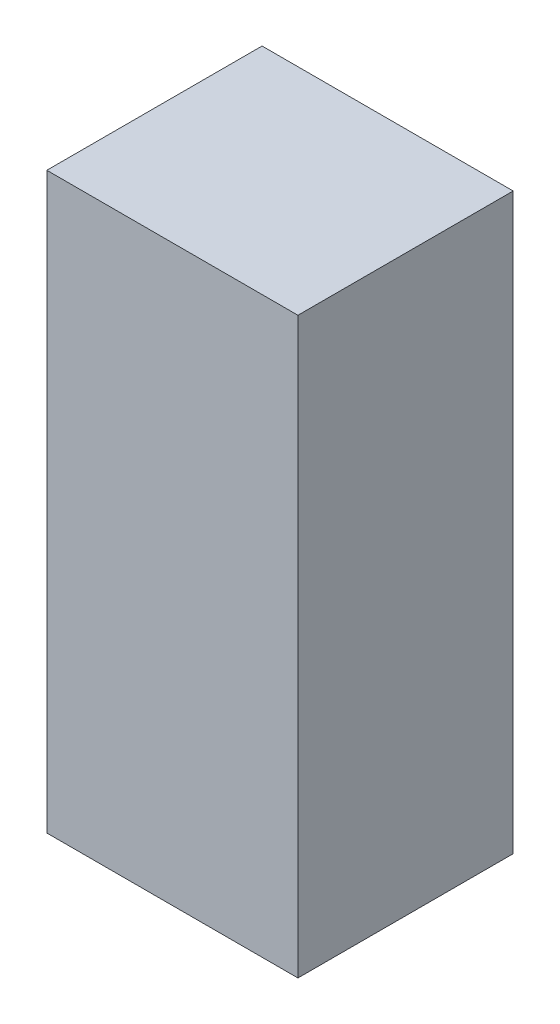
from build123d import *

# Parameters (mm, degrees)
SKETCH1_W           = 3.5
SKETCH1_H           = 3
BOSS_EXTRUDE1_DEPTH = 8


with BuildPart() as part:
    # Sketch1 → Boss-Extrude1 (new body)
    with BuildSketch(Plane(origin=(0, 0, 0), x_dir=(1, 0, 0), z_dir=(0, 1, 0))):
        Rectangle(SKETCH1_W, SKETCH1_H)
    extrude(amount=BOSS_EXTRUDE1_DEPTH)


solid = part.part
